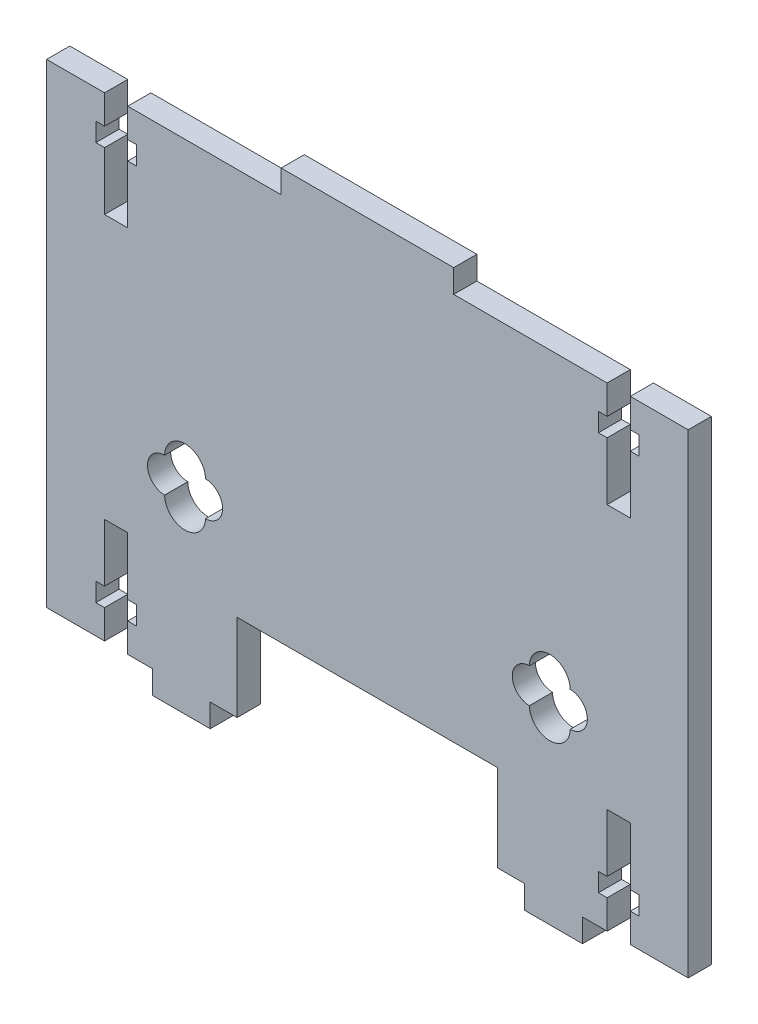
from build123d import *

# Parameters (mm, degrees)
SKETCH1_W           = 110.8
SKETCH1_H           = 82
BOSS_EXTRUDE1_DEPTH = 4
CUT_EXTRUDE1_DEPTH  = 10
SKETCH3_W           = 45
SKETCH3_H           = 15
CUT_EXTRUDE2_DEPTH  = 10
CUT_EXTRUDE3_DEPTH  = 10
SKETCH8_W           = 29.8
SKETCH8_H           = 4
BOSS_EXTRUDE2_DEPTH = 4
SKETCH9_W           = 10
SKETCH9_H           = 4
BOSS_EXTRUDE3_DEPTH = 4


with BuildPart() as part:
    # Sketch1 → Boss-Extrude1 (new body)
    with BuildSketch(Plane.XY):
        Rectangle(SKETCH1_W, SKETCH1_H)
    extrude(amount=BOSS_EXTRUDE1_DEPTH)

    # Sketch2 → Cut-Extrude1 (cut)
    with BuildSketch(Plane.XY.offset(4)):
        Polygon((41.4, -32.8), (41.4, -22.8), (45.4, -22.8), (45.4, -32.8), (46.9, -32.8), (46.9, -36), (45.4, -36), (45.4, -41), (41.4, -41), (41.4, -36), (39.9, -36), (39.9, -32.8), align=None)
        Polygon((-41.4, 32.8), (-41.4, 22.8), (-45.4, 22.8), (-45.4, 32.8), (-46.9, 32.8), (-46.9, 36), (-45.4, 36), (-45.4, 41), (-41.4, 41), (-41.4, 36), (-39.9, 36), (-39.9, 32.8), align=None)
        Polygon((45.4, 22.8), (45.4, 32.8), (46.9, 32.8), (46.9, 36), (45.4, 36), (45.4, 41), (41.4, 41), (41.4, 36), (39.9, 36), (39.9, 32.8), (41.4, 32.8), (41.4, 22.8), align=None)
        Polygon((-45.4, -22.8), (-45.4, -32.8), (-46.9, -32.8), (-46.9, -36), (-45.4, -36), (-45.4, -41), (-41.4, -41), (-41.4, -36), (-39.9, -36), (-39.9, -32.8), (-41.4, -32.8), (-41.4, -22.8), align=None)
    extrude(amount=-CUT_EXTRUDE1_DEPTH, mode=Mode.SUBTRACT)

    # Sketch3 → Cut-Extrude2 (cut)
    with BuildSketch(Plane.XY.offset(4)):
        with Locations((0, -33.5)):
            Rectangle(SKETCH3_W, SKETCH3_H)
    extrude(amount=-CUT_EXTRUDE2_DEPTH, mode=Mode.SUBTRACT)

    # Sketch6 → Cut-Extrude3 (cut)
    with BuildSketch(Plane.XY.offset(4)):
        with BuildLine():
            ThreePointArc((-35.03018163, -13.984149147), (-31.5, -17.463580565), (-27.96981837, -13.984149147))
            ThreePointArc((-27.96981837, -13.984149147), (-25.015698228, -11), (-27.96981837, -8.015850853))
            ThreePointArc((-27.96981837, -8.015850853), (-31.5, -4.536419435), (-35.03018163, -8.015850853))
            ThreePointArc((-35.03018163, -8.015850853), (-37.984301772, -11), (-35.03018163, -13.984149147))
        make_face()
        with BuildLine():
            ThreePointArc((27.96981837, -13.984149147), (25.015698228, -11), (27.96981837, -8.015850853))
            ThreePointArc((27.96981837, -8.015850853), (31.5, -4.536419435), (35.03018163, -8.015850853))
            ThreePointArc((35.03018163, -8.015850853), (37.984301772, -11), (35.03018163, -13.984149147))
            ThreePointArc((35.03018163, -13.984149147), (31.5, -17.463580565), (27.96981837, -13.984149147))
        make_face()
    extrude(amount=-CUT_EXTRUDE3_DEPTH, mode=Mode.SUBTRACT)

    # Sketch8 → Boss-Extrude2 (add)
    with BuildSketch(Plane.XY.offset(4)):
        with Locations((0, 43)):
            Rectangle(SKETCH8_W, SKETCH8_H)
    extrude(amount=-BOSS_EXTRUDE2_DEPTH)

    # Sketch9 → Boss-Extrude3 (add)
    with BuildSketch(Plane.XY.offset(4)):
        with Locations((-32.15, -43)):
            Rectangle(SKETCH9_W, SKETCH9_H)
        with Locations((32.15, -43)):
            Rectangle(SKETCH9_W, SKETCH9_H)
    extrude(amount=-BOSS_EXTRUDE3_DEPTH)


solid = part.part
